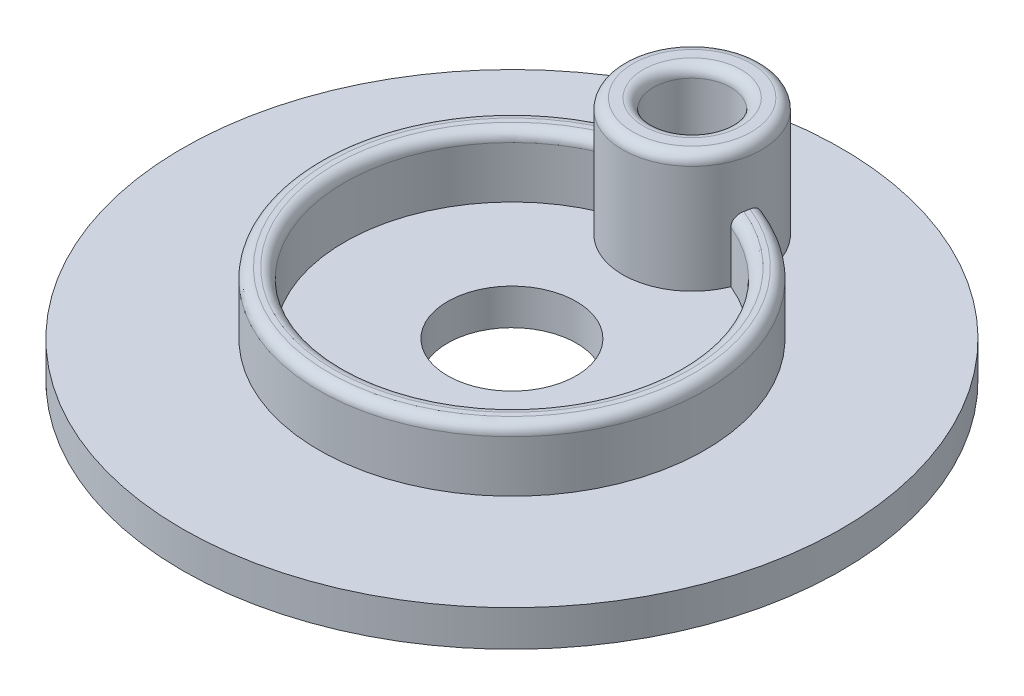
from build123d import *

# Parameters (mm, degrees)
SKETCH_4_R          = 64
EXTRUDE_1_DEPTH     = 7
SKETCH_5_R          = 37.5
SKETCH_5_R_2        = 32.5
EXTRUDE_2_DEPTH     = 12
SKETCH_7_R          = 12.5
CUT_EXTRUDE_1_DEPTH = 92.301697684
FILLET_1_R          = 2
SKETCH_10_R         = 13.5
EXTRUDE_3_DEPTH     = 30
SKETCH_11_R         = 7.5
CUT_EXTRUDE_2_DEPTH = 96.351979528
FILLET_2_R          = 2


with BuildPart() as part:
    # 草图4 → 凸台-拉伸1 (new body)
    with BuildSketch(Plane(origin=(0, 0, 0), x_dir=(1, 0, 0), z_dir=(0, 1, 0))):
        with Locations(Location((0, 0, 0), (0, 0, 270))):
            Circle(SKETCH_4_R)
    extrude(amount=EXTRUDE_1_DEPTH)

    # 草图5 → 凸台-拉伸2 (add)
    with BuildSketch(Plane(origin=(0, 7, 0), x_dir=(1, 0, 0), z_dir=(0, 1, 0))):
        with Locations(Location((0, 0, 0), (0, 0, 270))):
            Circle(SKETCH_5_R)
        with Locations(Location((0, 0, 0), (0, 0, 270))):
            Circle(SKETCH_5_R_2, mode=Mode.SUBTRACT)
    extrude(amount=EXTRUDE_2_DEPTH)

    # 草图7 → 切除-拉伸1 (cut, through all)
    with BuildSketch(Plane(origin=(0, 7, 0), x_dir=(1, 0, 0), z_dir=(0, 1, 0))):
        with Locations(Location((0, 0, 0), (0, 0, 270))):
            Circle(SKETCH_7_R)
    extrude(amount=-CUT_EXTRUDE_1_DEPTH, mode=Mode.SUBTRACT)

    # 圆角1
    fillet_1_edges = [part.edges().sort_by_distance(p)[0] for p in [
        (0, 19, -32.5),
        (0, 19, -37.5),
    ]]
    fillet(fillet_1_edges, radius=FILLET_1_R)

    # 草图10 → 凸台-拉伸3 (add)
    with BuildSketch(Plane(origin=(0, 0, 0), x_dir=(1, 0, 0), z_dir=(0, 1, 0))):
        with Locations(Location((0, 35, 0), (0, 0, 359.939369671))):
            Circle(SKETCH_10_R)
    extrude(amount=EXTRUDE_3_DEPTH)

    # 草图11 → 切除-拉伸2 (cut, through all)
    with BuildSketch(Plane(origin=(0, 30, 0), x_dir=(1, 0, 0), z_dir=(0, 1, 0))):
        with Locations(Location((0, 35, 0), (0, 0, 270))):
            Circle(SKETCH_11_R)
    extrude(amount=-CUT_EXTRUDE_2_DEPTH, mode=Mode.SUBTRACT)

    # 圆角2
    fillet_2_edges = [part.edges().sort_by_distance(p)[0] for p in [
        (-13.499992441, 30, -35.014285682),
        (0, 30, -42.5),
    ]]
    fillet(fillet_2_edges, radius=FILLET_2_R)


solid = part.part
